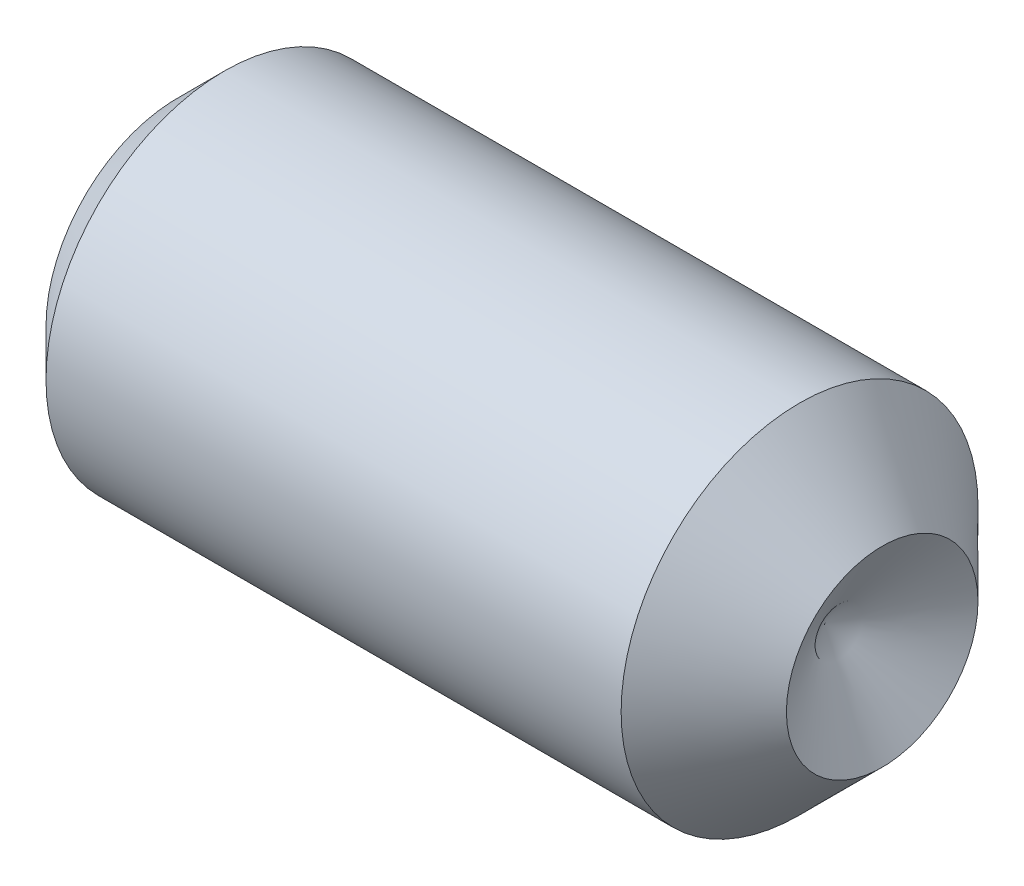
from build123d import *

# Parameters (mm, degrees)
HEX_2_DEPTH = 2.54


with BuildPart() as part:
    # BodySke → BaseBody (revolve)
    with BuildSketch(Plane.XY, mode=Mode.PRIVATE) as basebody_sk:
        Polygon((0, 0), (0, 1.78308), (0.62992, 2.413), (8.4074, 2.413), (9.525, 1.2954), (8.746645154, 0), align=None)
    revolve(basebody_sk.sketch.rotate(Axis((-12.7, 0, 0), (1, 0, 0)), 90), axis=Axis((-12.7, 0, 0), (1, 0, 0)))

    # Sketch2 → Hex 2 (cut)
    with BuildSketch(Plane.ZY):
        Polygon((0.687041047, 1.18999), (-0.687041047, 1.18999), (-1.374082094, 0), (-0.687041047, -1.18999), (0.687041047, -1.18999), (1.374082094, 0), align=None)
    extrude(amount=-HEX_2_DEPTH, mode=Mode.SUBTRACT)


solid = part.part
